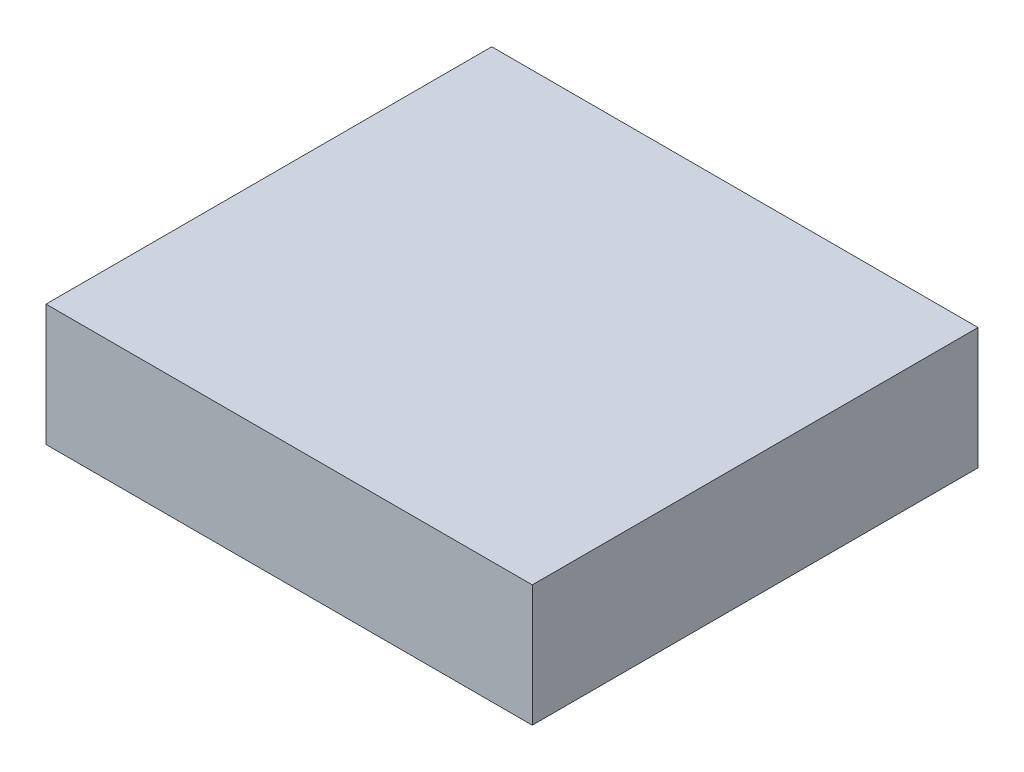
from build123d import *

# Parameters (mm, degrees)
SKETCH1_W           = 152.4
SKETCH1_H           = 139.7
BOSS_EXTRUDE1_DEPTH = 38.1


with BuildPart() as part:
    # Sketch1 → Boss-Extrude1 (new body)
    with BuildSketch(Plane(origin=(0, 0, 0), x_dir=(1, 0, 0), z_dir=(0, 1, 0))):
        Rectangle(SKETCH1_W, SKETCH1_H)
    extrude(amount=BOSS_EXTRUDE1_DEPTH)


solid = part.part
